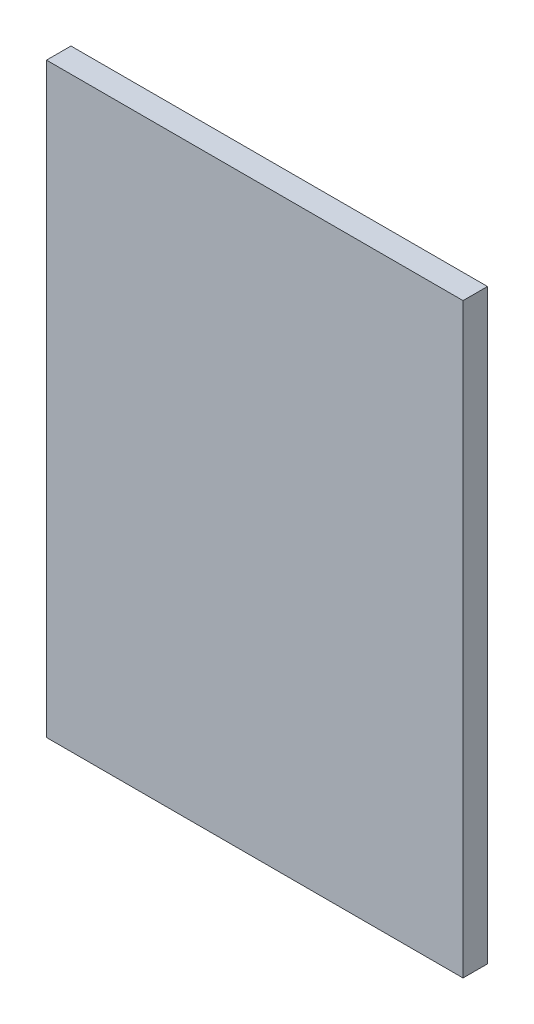
from build123d import *

# Parameters (mm, degrees)
SKETCH1_W           = 54.102
SKETCH1_H           = 76.2
BOSS_EXTRUDE2_DEPTH = 3.175


with BuildPart() as part:
    # Sketch1 → Boss-Extrude2 (new body)
    with BuildSketch(Plane.XY):
        with Locations((-27.051, 44.326590106)):
            Rectangle(SKETCH1_W, SKETCH1_H)
    extrude(amount=BOSS_EXTRUDE2_DEPTH)


solid = part.part
